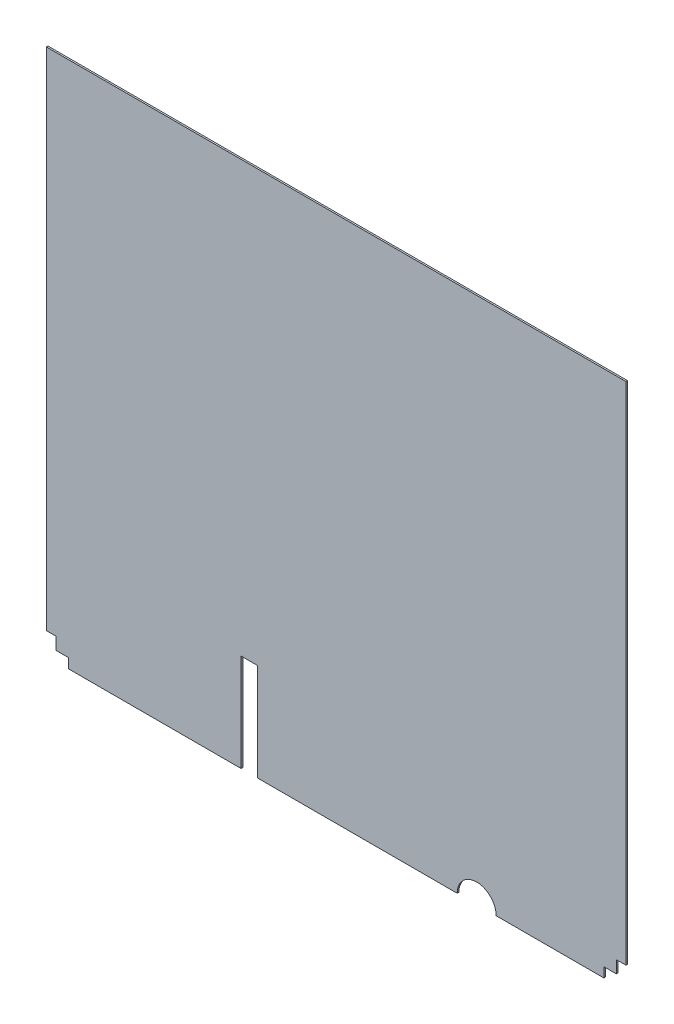
from build123d import *

# Parameters (mm, degrees)
BOSS_EXTRUDE1_DEPTH = 2.54


with BuildPart() as part:
    # Sketch1 → Boss-Extrude1 (new body)
    with BuildSketch(Plane.XY):
        with BuildLine():
            Line((0, 825.5), (0, 34.544))
            Line((0, 34.544), (15.24, 34.544))
            Line((15.24, 34.544), (15.24, 15.24))
            Line((15.24, 15.24), (34.544, 15.24))
            Line((34.544, 15.24), (34.544, 0))
            Line((34.544, 0), (304.8, 0))
            Line((304.8, 0), (304.8, 152.4))
            Line((304.8, 152.4), (330.2, 152.4))
            Line((330.2, 152.4), (330.2, 0))
            Line((330.2, 0), (642.84098, 0))
            ThreePointArc((642.84098, 0), (673.32098, 30.48), (703.80098, 0))
            Line((703.80098, 0), (872.45698, 0))
            Line((872.45698, 0), (872.45698, 15.24))
            Line((872.45698, 15.24), (891.76098, 15.24))
            Line((891.76098, 15.24), (891.76098, 34.544))
            Line((891.76098, 34.544), (907.00098, 34.544))
            Line((907.00098, 34.544), (907.00098, 825.5))
            Line((907.00098, 825.5), (0, 825.5))
        make_face()
    extrude(amount=BOSS_EXTRUDE1_DEPTH)


solid = part.part
